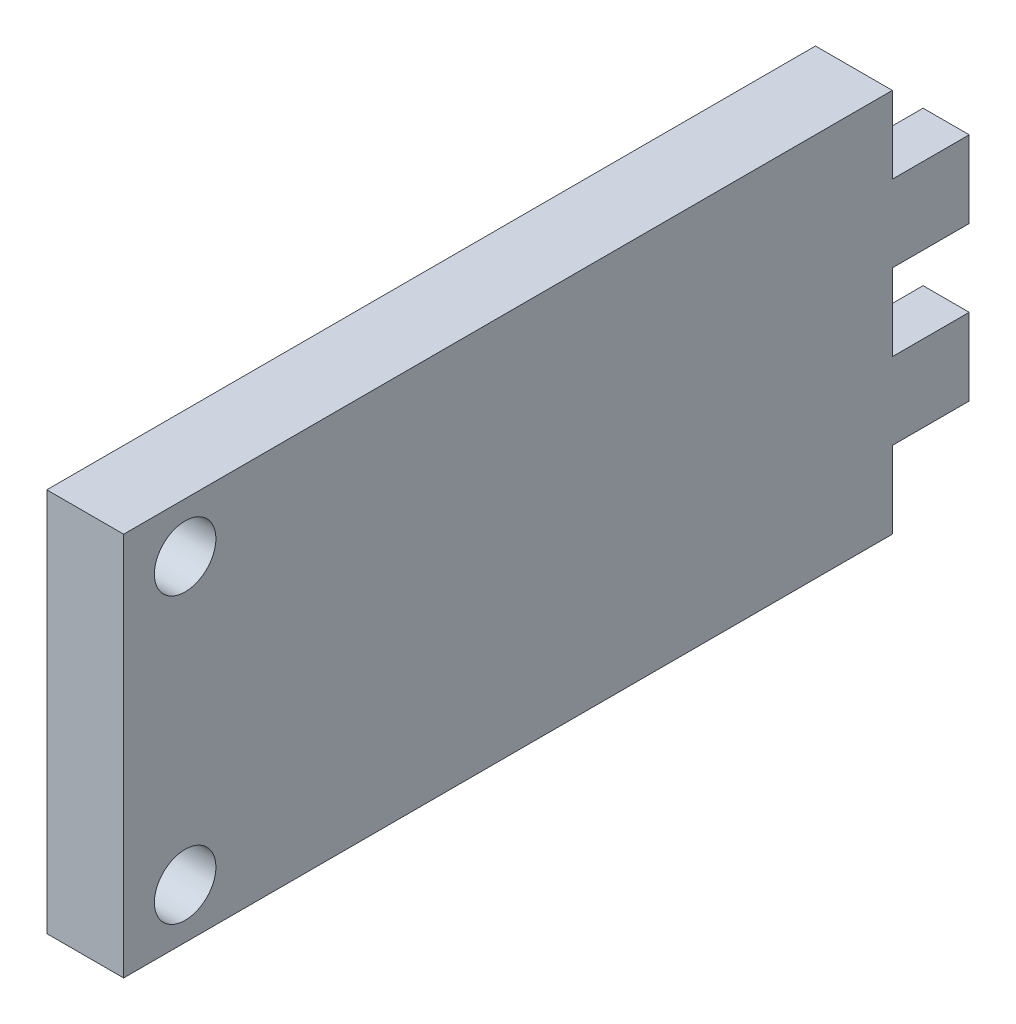
from build123d import *

# Parameters (mm, degrees)
SKETCH1_W           = 5
SKETCH1_H           = 25
BOSS_EXTRUDE1_DEPTH = 50
SKETCH2_R           = 2
CUT_EXTRUDE1_DEPTH  = 15
SKETCH3_W           = 3
SKETCH3_H           = 4.998554169
SKETCH3_H_2         = 5
BOSS_EXTRUDE2_DEPTH = 5


with BuildPart() as part:
    # Sketch1 → Boss-Extrude1 (new body)
    with BuildSketch(Plane.XY):
        with Locations((8.657024793, -1.859504132)):
            Rectangle(SKETCH1_W, SKETCH1_H)
    extrude(amount=BOSS_EXTRUDE1_DEPTH)

    # Sketch2 → Cut-Extrude1 (cut)
    with BuildSketch(Plane.ZY.offset(-6.157024793)):
        with Locations(Location((46, -11.109504132, 0), (0, 0, 270))):
            Circle(SKETCH2_R)
        with Locations(Location((46, 7.390495868, 0), (0, 0, 270))):
            Circle(SKETCH2_R)
    extrude(amount=-CUT_EXTRUDE1_DEPTH, mode=Mode.SUBTRACT)

    # Sketch3 → Boss-Extrude2 (add)
    with BuildSketch(Plane(origin=(0, 0, 0), x_dir=(-1, 0, 0), z_dir=(0, 0, -1))):
        with Locations((-9.657024793, 3.139772953)):
            Rectangle(SKETCH3_W, SKETCH3_H)
        with Locations((-9.657024793, -6.859504132)):
            Rectangle(SKETCH3_W, SKETCH3_H_2)
    extrude(amount=BOSS_EXTRUDE2_DEPTH)


solid = part.part
